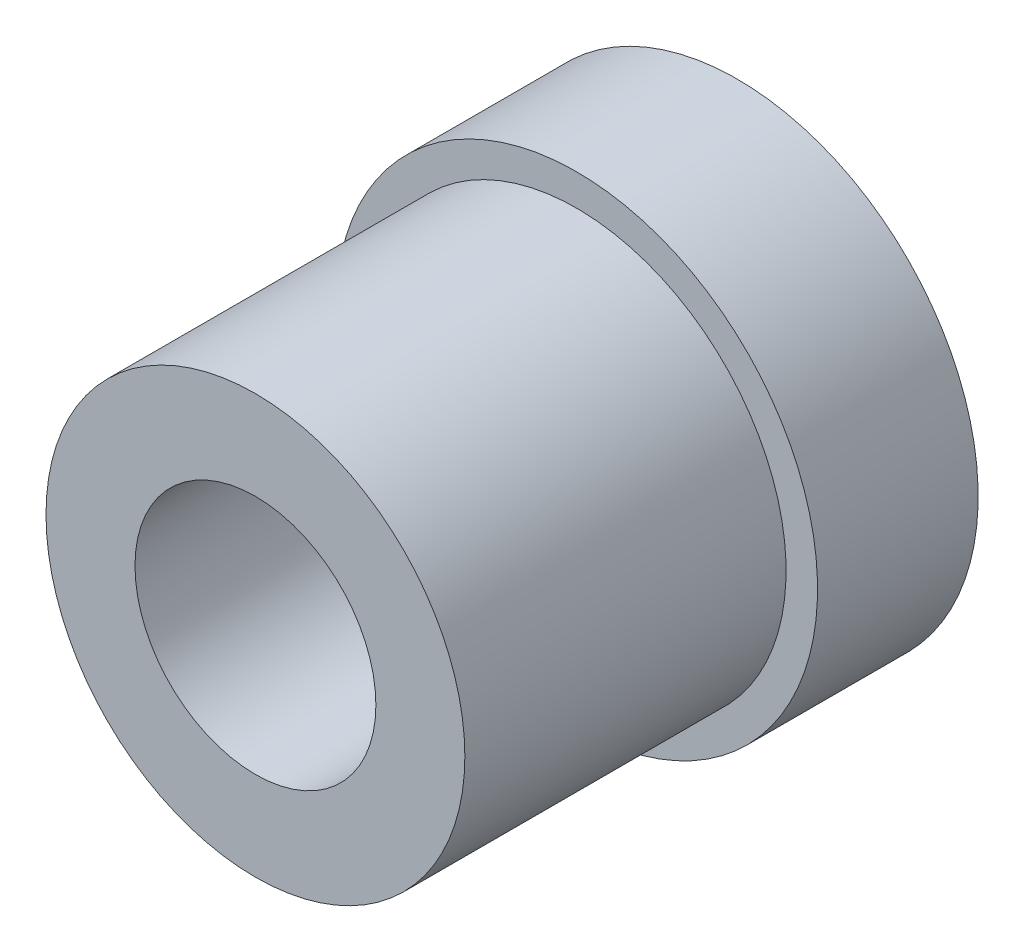
from build123d import *
from build123d.topology import SkipClean

# Parameters (mm, degrees)
SKETCH2_R           = 8.2804
SKETCH2_R_2         = 4.7625
BOSS_EXTRUDE1_DEPTH = 12.7
BOSS_EXTRUDE2_START = 6.35
SKETCH3_R           = 9.525
SKETCH3_R_2         = 4.7625
BOSS_EXTRUDE2_DEPTH = 6.35


with BuildPart() as part:
    # Sketch2 → Boss-Extrude1 (new body)
    with BuildSketch(Plane.XY):
        Circle(SKETCH2_R)
        Circle(SKETCH2_R_2, mode=Mode.SUBTRACT)
    extrude(amount=BOSS_EXTRUDE1_DEPTH)

    # Sketch3 → Boss-Extrude2 (add)
    with SkipClean():  # the faces are left unmerged after this step: merging them gives an invalid solid
        with BuildSketch(Plane(origin=(0, 0, 0), x_dir=(-1, 0, 0), z_dir=(0, 0, -1)).offset(BOSS_EXTRUDE2_START)):
            Circle(SKETCH3_R)
            Circle(SKETCH3_R_2, mode=Mode.SUBTRACT)
        extrude(amount=-BOSS_EXTRUDE2_DEPTH)


solid = part.part
